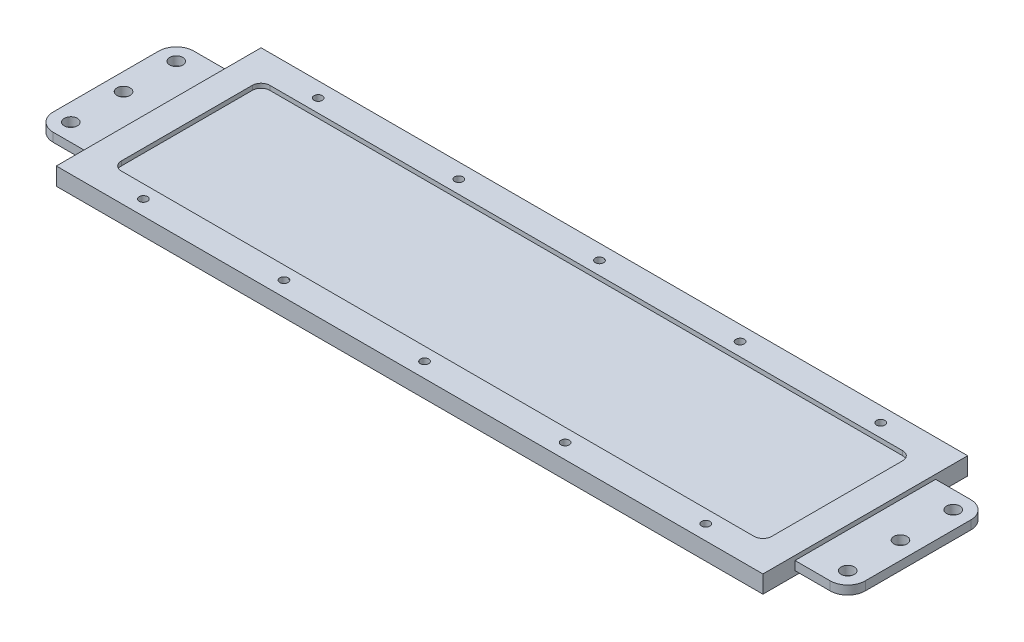
from build123d import *

# Parameters (mm, degrees)
BOSS_EXTRUDE1_DEPTH      = 1.5875
BOSS_EXTRUDE1_DEPTH_BACK = 1.5875
SKETCH1_R                = 1.5
SKETCH1_R_2              = 2.38125
BOSS_EXTRUDE2_DEPTH      = 3.175
BOSS_EXTRUDE2_DEPTH_BACK = 3.175
SKETCH1_4_W              = 255.27
SKETCH1_4_H              = 73.96988
CUT_EXTRUDE1_DEPTH       = 1.5875
CUT_EXTRUDE2_DEPTH       = 3.175
CUT_EXTRUDE2_DEPTH_BACK  = 3.175
SKETCH1_6_R              = 1.5


with BuildPart() as part:
    # Sketch1 → Boss-Extrude1 (new, two sides: drawn at the far end of the back side and taken through both)
    with BuildSketch(Plane(origin=(0, 0, 0), x_dir=(1, 0, 0), z_dir=(0, 1, 0)).offset(-BOSS_EXTRUDE1_DEPTH_BACK)):
        with BuildLine():
            Line((0, 11.58494), (0, 0))
            Line((0, 0), (255.27, 0))
            Line((255.27, 0), (255.27, 11.58494))
            Line((255.27, 11.58494), (267.97, 11.58494))
            ThreePointArc((267.97, 11.58494), (272.460128061, 13.444811939), (274.32, 17.93494))
            Line((274.32, 17.93494), (274.32, 56.03494))
            ThreePointArc((274.32, 56.03494), (272.460128061, 60.525068061), (267.97, 62.38494))
            Line((267.97, 62.38494), (255.27, 62.38494))
            Line((255.27, 62.38494), (255.27, 73.96988))
            Line((255.27, 73.96988), (0, 73.96988))
            Line((0, 73.96988), (0, 62.38494))
            Line((0, 62.38494), (-12.7, 62.38494))
            ThreePointArc((-12.7, 62.38494), (-17.190128061, 60.525068061), (-19.05, 56.03494))
            Line((-19.05, 56.03494), (-19.05, 17.93494))
            ThreePointArc((-19.05, 17.93494), (-17.190128061, 13.444811939), (-12.7, 11.58494))
            Line((-12.7, 11.58494), (0, 11.58494))
        make_face()
        with Locations((26.035, 5.3975)):
            Circle(SKETCH1_R, mode=Mode.SUBTRACT)
        with Locations((76.835, 5.3975)):
            Circle(SKETCH1_R, mode=Mode.SUBTRACT)
        with Locations((127.635, 5.3975)):
            Circle(SKETCH1_R, mode=Mode.SUBTRACT)
        with Locations((178.435, 5.3975)):
            Circle(SKETCH1_R, mode=Mode.SUBTRACT)
        with Locations((229.235, 5.3975)):
            Circle(SKETCH1_R, mode=Mode.SUBTRACT)
        with Locations((26.035, 68.57238)):
            Circle(SKETCH1_R, mode=Mode.SUBTRACT)
        with Locations((76.835, 68.57238)):
            Circle(SKETCH1_R, mode=Mode.SUBTRACT)
        with Locations((127.635, 68.57238)):
            Circle(SKETCH1_R, mode=Mode.SUBTRACT)
        with Locations((178.435, 68.57238)):
            Circle(SKETCH1_R, mode=Mode.SUBTRACT)
        with Locations((229.235, 68.57238)):
            Circle(SKETCH1_R, mode=Mode.SUBTRACT)
        with Locations((-12.7, 56.03494)):
            Circle(SKETCH1_R_2, mode=Mode.SUBTRACT)
        with Locations((-12.7, 17.93494)):
            Circle(SKETCH1_R_2, mode=Mode.SUBTRACT)
        with Locations((-12.7, 36.98494)):
            Circle(SKETCH1_R_2, mode=Mode.SUBTRACT)
        with Locations((267.97, 56.03494)):
            Circle(SKETCH1_R_2, mode=Mode.SUBTRACT)
        with Locations((267.97, 17.93494)):
            Circle(SKETCH1_R_2, mode=Mode.SUBTRACT)
        with Locations((267.97, 36.98494)):
            Circle(SKETCH1_R_2, mode=Mode.SUBTRACT)
    extrude(amount=BOSS_EXTRUDE1_DEPTH + BOSS_EXTRUDE1_DEPTH_BACK)

    # Sketch1<4> → Boss-Extrude2 (add, two sides: drawn at the far end of the back side and taken through both)
    with BuildSketch(Plane(origin=(0, 0, 0), x_dir=(1, 0, 0), z_dir=(0, 1, 0)).offset(-BOSS_EXTRUDE2_DEPTH_BACK)):
        with Locations((127.635, 36.98494)):
            Rectangle(SKETCH1_4_W, SKETCH1_4_H)
    extrude(amount=BOSS_EXTRUDE2_DEPTH + BOSS_EXTRUDE2_DEPTH_BACK)

    # Sketch2 → Cut-Extrude1 (cut)
    with BuildSketch(Plane(origin=(0, 3.175, 0), x_dir=(1, 0, 0), z_dir=(0, 1, 0))):
        with BuildLine():
            Line((13.335, 63.80988), (241.935, 63.80988))
            ThreePointArc((241.935, 63.80988), (244.18006403, 62.87994403), (245.11, 60.63488))
            Line((245.11, 60.63488), (245.11, 13.335))
            ThreePointArc((245.11, 13.335), (244.18006403, 11.08993597), (241.935, 10.16))
            Line((241.935, 10.16), (13.335, 10.16))
            ThreePointArc((13.335, 10.16), (11.08993597, 11.08993597), (10.16, 13.335))
            Line((10.16, 13.335), (10.16, 60.63488))
            ThreePointArc((10.16, 60.63488), (11.08993597, 62.87994403), (13.335, 63.80988))
        make_face()
    cut_extrude1 = extrude(amount=-CUT_EXTRUDE1_DEPTH, mode=Mode.SUBTRACT)

    # Mirror1: Cut-Extrude1 across plane
    add(cut_extrude1.mirror(Plane.ZX), mode=Mode.SUBTRACT)

    # Sketch1<6> → Cut-Extrude2 (cut, two sides: drawn at the far end of the back side and taken through both)
    with BuildSketch(Plane(origin=(0, 0, 0), x_dir=(1, 0, 0), z_dir=(0, 1, 0)).offset(-CUT_EXTRUDE2_DEPTH_BACK)):
        with Locations((178.435, 68.57238)):
            Circle(SKETCH1_6_R)
        with Locations((178.435, 5.3975)):
            Circle(SKETCH1_6_R)
        with Locations((229.235, 68.57238)):
            Circle(SKETCH1_6_R)
        with Locations((229.235, 5.3975)):
            Circle(SKETCH1_6_R)
        with Locations((127.635, 68.57238)):
            Circle(SKETCH1_6_R)
        with Locations((127.635, 5.3975)):
            Circle(SKETCH1_6_R)
        with Locations((26.035, 5.3975)):
            Circle(SKETCH1_6_R)
        with Locations((76.835, 5.3975)):
            Circle(SKETCH1_6_R)
        with Locations((26.035, 68.57238)):
            Circle(SKETCH1_6_R)
        with Locations((76.835, 68.57238)):
            Circle(SKETCH1_6_R)
    extrude(amount=CUT_EXTRUDE2_DEPTH + CUT_EXTRUDE2_DEPTH_BACK, mode=Mode.SUBTRACT)


solid = part.part
